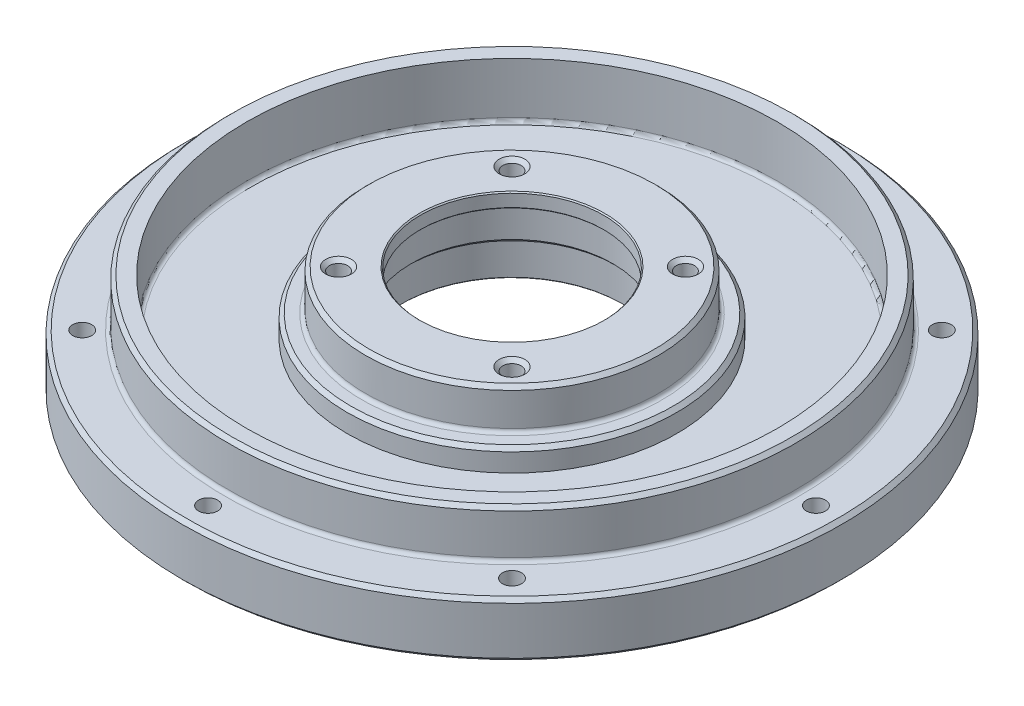
from build123d import *

# Parameters (mm, degrees)
SKETCH_1_R                           = 90
EXTRUDE_1_DEPTH                      = 30
CHAMFER_1_SIZE                       = 1
CHAMFER_3_SIZE                       = 1
CHAMFER_4_SIZE                       = 0.3
FILLET_1_R                           = 1
SKETCH_4_R                           = 1.1
CUT_EXTRUDE_1_DEPTH                  = 131.766968306
CUT_EXTRUDE_START                    = 11
SKETCH_4_3_R                         = 2.5
CUT_EXTRUDE_2_DEPTH                  = 120.766968306
CUT_EXTRUDE_START_2                  = 9
SKETCH_4_4_R                         = 1.1
CUT_EXTRUDE_3_DEPTH                  = 2
CHAMFER_5_SIZE                       = 1
PATTERN_CIRCULAR_1_COUNT             = 4
CHAMFER_5_OF_PATTERN_CIRCULAR_1_SIZE = 1
SKETCH_5_R                           = 2.6
CUT_EXTRUDE_4_DEPTH                  = 131.766968306


with BuildPart() as part:
    # Эскиз1 → Бобышка-Вытянуть1 (new body)
    with BuildSketch(Plane(origin=(0, 0, 0), x_dir=(1, 0, 0), z_dir=(0, 1, 0))):
        Circle(SKETCH_1_R)
    extrude(amount=EXTRUDE_1_DEPTH)

    # Эскиз2 → Вырез-Повернуть1 (revolve, cut)
    with BuildSketch(Plane(origin=(0, 0, 0), x_dir=(0, 0, -1), z_dir=(1, 0, 0))):
        Polygon((-38, 0), (0, 0), (0, 67.414866474), (-25, 67.414866474), (-25, 26), (-27.5, 26), (-27.5, 16), (-30, 16), (-30, 6), (-38, 6), align=None)
    revolve(axis=Axis((0, 67.414866474, 0), (0, -1, 0)), mode=Mode.SUBTRACT)

    # Эскиз3 → Вырез-Повернуть2 (revolve, cut)
    with BuildSketch(Plane(origin=(0, 0, 0), x_dir=(0, 0, -1), z_dir=(1, 0, 0))):
        Polygon((-40, 30), (0, 30), (0, 53.537203253), (-112.622574603, 53.537203253), (-112.622574603, 15), (-77.5, 15), (-77.5, 28), (-72.5, 28), (-72.5, 13), (-45, 13), (-45, 19), (-40, 19), align=None)
    revolve(axis=Axis((0, 0, 0), (0, 1, 0)), mode=Mode.SUBTRACT)

    # Фаска1
    chamfer_1_edges = [part.edges().sort_by_distance(p)[0] for p in [
        (0, 16, -27.5),
        (0, 19, -45),
    ]]
    chamfer(chamfer_1_edges, length=CHAMFER_1_SIZE)

    # Фаска3
    chamfer_3_edges = [part.edges().sort_by_distance(p)[0] for p in [
        (0, 0, -38),
        (-90, 0, 0),
        (0, 30, -40),
        (0, 28, -77.5),
        (-90, 15, 0),
    ]]
    chamfer(chamfer_3_edges, length=CHAMFER_3_SIZE)

    # Фаска4
    chamfer_4_edges = [part.edges().sort_by_distance(p)[0] for p in [
        (0, 30, -25),
        (0, 26, -25),
        (0, 6, -30),
    ]]
    chamfer(chamfer_4_edges, length=CHAMFER_4_SIZE)

    # Скругление1
    fillet_1_edges = [part.edges().sort_by_distance(p)[0] for p in [
        (0, 19, -40),
        (0, 13, -72.5),
        (0, 15, -77.5),
    ]]
    fillet(fillet_1_edges, radius=FILLET_1_R)

    # Эскиз4 → Вырез-Вытянуть1 (cut, through all)
    with BuildSketch(Plane(origin=(0, 0, 0), x_dir=(1, 0, 0), z_dir=(0, 1, 0))):
        with Locations((23.68807717, 23.68807717)):
            Circle(SKETCH_4_R)
    cut_extrude_1 = extrude(amount=CUT_EXTRUDE_1_DEPTH, mode=Mode.SUBTRACT)

    # Эскиз4<3> → Вырез-Вытянуть2 (cut, through all)
    with BuildSketch(Plane(origin=(0, 0, 0), x_dir=(1, 0, 0), z_dir=(0, 1, 0)).offset(CUT_EXTRUDE_START)):
        with Locations((23.68807717, 23.68807717)):
            Circle(SKETCH_4_3_R)
    cut_extrude_2 = extrude(amount=CUT_EXTRUDE_2_DEPTH, mode=Mode.SUBTRACT)

    # Эскиз4<4> → Вырез-Вытянуть3 (cut)
    with BuildSketch(Plane(origin=(0, 0, 0), x_dir=(1, 0, 0), z_dir=(0, 1, 0)).offset(CUT_EXTRUDE_START_2)):
        Polygon((23.075417264, 21.401599273), (25.361895161, 22.014259179), (25.974555067, 24.300737076), (24.300737076, 25.974555067), (22.014259179, 25.361895161), (21.401599273, 23.075417264), align=None)
        with Locations((23.68807717, 23.68807717)):
            Circle(SKETCH_4_4_R, mode=Mode.SUBTRACT)
    cut_extrude_3 = extrude(amount=CUT_EXTRUDE_3_DEPTH, mode=Mode.SUBTRACT)

    # Фаска5
    chamfer_5_edges = [part.edges().sort_by_distance(p)[0] for p in [
        (21.18807717, 30, -23.68807717),
    ]]
    chamfer(chamfer_5_edges, length=CHAMFER_5_SIZE)

    # Круговой массив1: Вырез-Вытянуть1, Вырез-Вытянуть2, Вырез-Вытянуть3 ×4 about axis
    pattern_circular_1_axis = Axis((0, 0, 0), (0, -1, 0))
    add([cut_extrude_1.rotate(pattern_circular_1_axis, i * 360 / PATTERN_CIRCULAR_1_COUNT) for i in range(1, PATTERN_CIRCULAR_1_COUNT)], mode=Mode.SUBTRACT)
    add([cut_extrude_2.rotate(pattern_circular_1_axis, i * 360 / PATTERN_CIRCULAR_1_COUNT) for i in range(1, PATTERN_CIRCULAR_1_COUNT)], mode=Mode.SUBTRACT)
    add([cut_extrude_3.rotate(pattern_circular_1_axis, i * 360 / PATTERN_CIRCULAR_1_COUNT) for i in range(1, PATTERN_CIRCULAR_1_COUNT)], mode=Mode.SUBTRACT)

    # Фаска5 of Круговой массив1
    chamfer_5_of_pattern_circular_1_edges = [part.edges().sort_by_distance(p)[0] for p in [
        (23.68807717, 30, 21.18807717),
        (-21.18807717, 30, 23.68807717),
        (-23.68807717, 30, -21.18807717),
    ]]
    chamfer(chamfer_5_of_pattern_circular_1_edges, length=CHAMFER_5_OF_PATTERN_CIRCULAR_1_SIZE)

    # Эскиз5 → Вырез-Вытянуть4 (cut, through all)
    with BuildSketch(Plane(origin=(0, 0, 0), x_dir=(1, 0, 0), z_dir=(0, 1, 0))):
        with Locations((83, 0)):
            Circle(SKETCH_5_R)
        with Locations((58.689862838, -58.689862838)):
            Circle(SKETCH_5_R)
        with Locations((0, -83)):
            Circle(SKETCH_5_R)
        with Locations((-58.689862838, -58.689862838)):
            Circle(SKETCH_5_R)
        with Locations((-83, 0)):
            Circle(SKETCH_5_R)
        with Locations((-58.689862838, 58.689862838)):
            Circle(SKETCH_5_R)
        with Locations((0, 83)):
            Circle(SKETCH_5_R)
        with Locations((58.689862838, 58.689862838)):
            Circle(SKETCH_5_R)
    extrude(amount=CUT_EXTRUDE_4_DEPTH, mode=Mode.SUBTRACT)


solid = part.part
